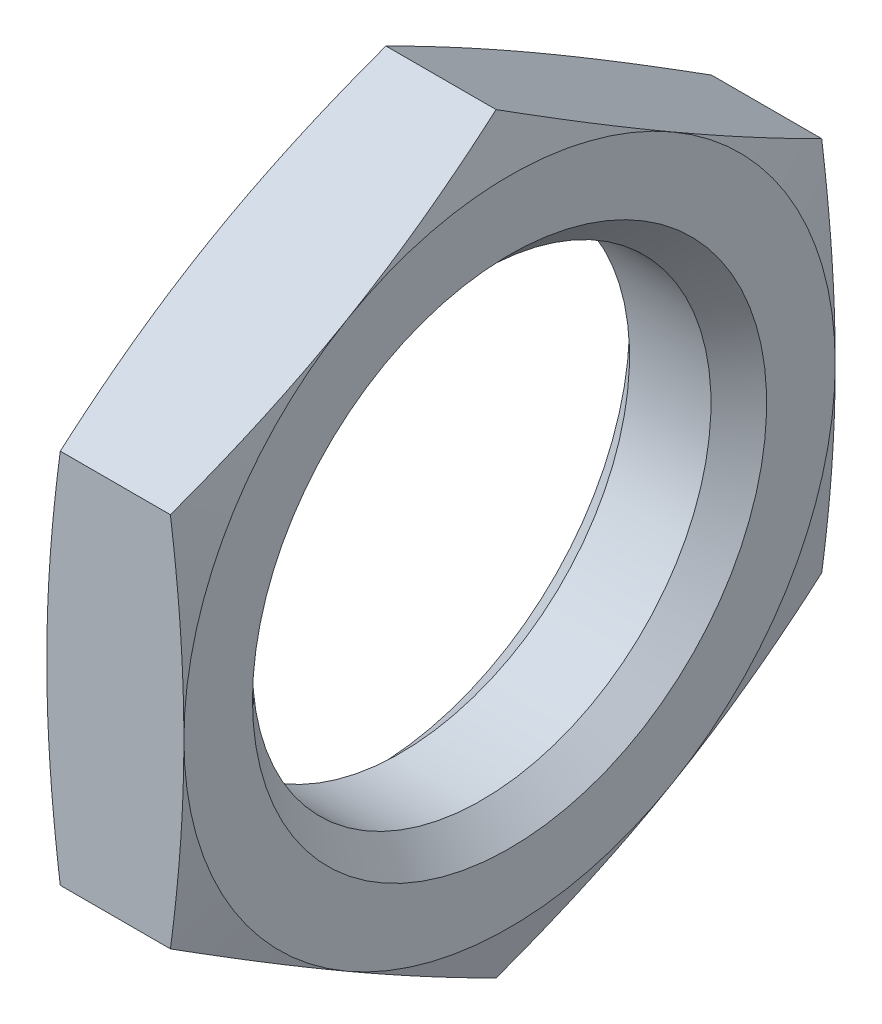
from build123d import *

# Parameters (mm, degrees)
SKETCH_2_R          = 40
CUT_EXTRUDE_1_DEPTH = 4


with BuildPart() as part:
    # 草图1 → 旋转1 (revolve)
    with BuildSketch(Plane.XY, mode=Mode.PRIVATE) as revolve_1_sk:
        Polygon((0, 9.5), (0, 7.5), (0.812, 6.688), (3.188, 6.688), (4, 7.5), (4, 9.5), (2.472689603, 15.2), (1.527310397, 15.2), align=None)
    revolve(revolve_1_sk.sketch.rotate(Axis((4, 0, 0), (-1, 0, 0)), 270), axis=Axis((4, 0, 0), (-1, 0, 0)))

    # 草图2 → 切除-拉伸1 (cut)
    with BuildSketch(Plane(origin=(0, 0, 0), x_dir=(0, 0, -1), z_dir=(1, 0, 0))):
        Circle(SKETCH_2_R)
        Polygon((-9.5, -5.484827557), (0, -10.969655115), (9.5, -5.484827557), (9.5, 5.484827557), (0, 10.969655115), (-9.5, 5.484827557), align=None, mode=Mode.SUBTRACT)
    extrude(amount=CUT_EXTRUDE_1_DEPTH, mode=Mode.SUBTRACT)


solid = part.part
